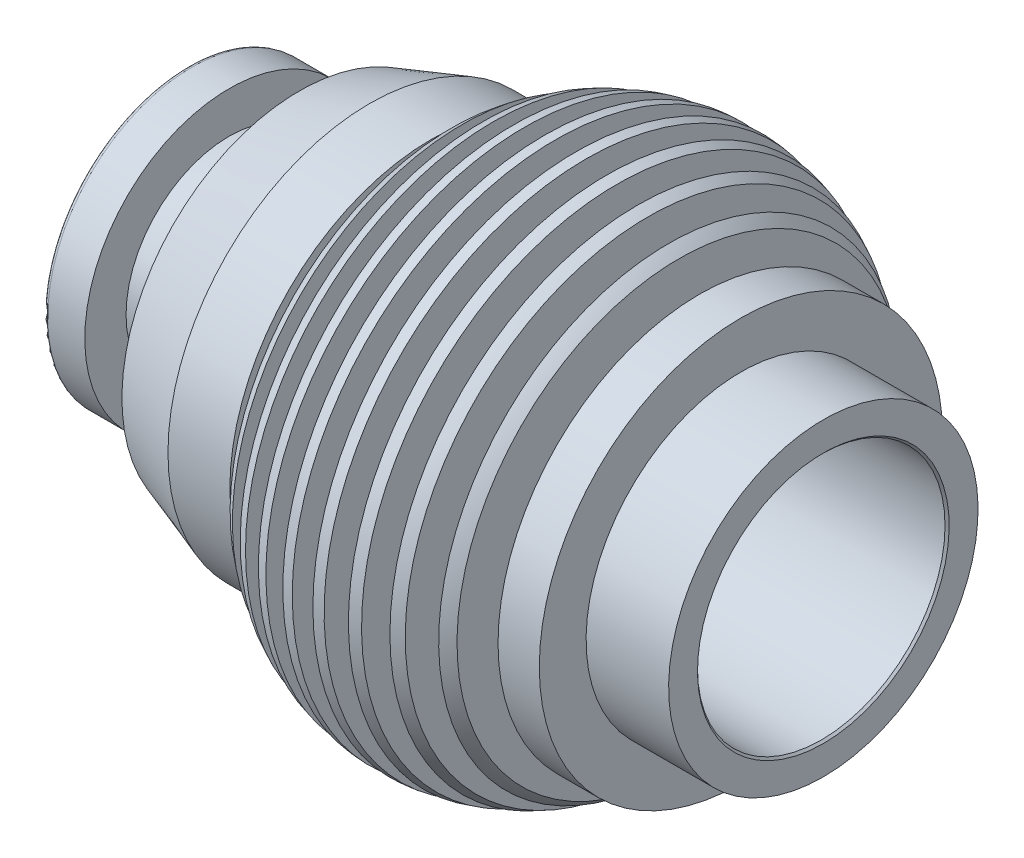
from build123d import *

# Parameters (mm, degrees)
SKETCH4_R          = 7.5
CUT_EXTRUDE1_DEPTH = 179.440382209
CIRPATTERN1_COUNT  = 9
CHAMFER1_SIZE      = 0.5
FILLET2_R          = 1


with BuildPart() as part:
    # Sketch1 → Revolve1 (revolve)
    with BuildSketch(Plane.XY):
        with BuildLine():
            Line((0, 35), (0, 15))
            Line((0, 15), (54, 15))
            Line((54, 15), (54, 30))
            Line((54, 30), (154, 30))
            Line((154, 30), (154, 37.5))
            Line((154, 37.5), (134, 37.5))
            Line((134, 37.5), (134.019334361, 48.86))
            Line((134.019334361, 48.86), (124.019334361, 48.86))
            Line((124.019334361, 48.86), (124.019334361, 40))
            Line((124.019334361, 40), (119.019334361, 40))
            Line((119.019334361, 40), (119.019334361, 53.806804209))
            ThreePointArc((119.019334361, 53.806804209), (117.787313388, 54.801644975), (116.519334361, 55.750229717))
            Line((116.519334361, 55.750229717), (116.519334361, 40))
            Line((116.519334361, 40), (111.519334361, 40))
            Line((111.519334361, 40), (111.519334361, 58.850307256))
            ThreePointArc((111.519334361, 58.850307256), (110.279240504, 59.480194874), (109.019334361, 60.069455171))
            Line((109.019334361, 60.069455171), (109.019334361, 40))
            Line((109.019334361, 40), (104.019334361, 40))
            Line((104.019334361, 40), (104.019334361, 61.94463843))
            ThreePointArc((104.019334361, 61.94463843), (102.774492344, 62.304270611), (101.519334361, 62.626055303))
            Line((101.519334361, 62.626055303), (101.519334361, 40))
            Line((101.519334361, 40), (96.519334361, 40))
            Line((96.519334361, 40), (96.519334361, 63.51762606))
            ThreePointArc((96.519334361, 63.51762606), (95.27094714, 63.645948403), (94.019334361, 63.737614791))
            Line((94.019334361, 63.737614791), (94.019334361, 40))
            Line((94.019334361, 40), (89.019334361, 40))
            Line((89.019334361, 40), (89.019334361, 63.737626161))
            ThreePointArc((89.019334361, 63.737626161), (87.767721666, 63.64596551), (86.519334361, 63.517648918))
            Line((86.519334361, 63.517648918), (86.519334361, 40))
            Line((86.519334361, 40), (81.519334361, 40))
            Line((81.519334361, 40), (81.519334361, 62.626101999))
            ThreePointArc((81.519334361, 62.626101999), (80.26417648, 62.304323607), (79.019334361, 61.944697773))
            Line((79.019334361, 61.944697773), (79.019334361, 40))
            Line((79.019334361, 40), (74.019334361, 40))
            Line((74.019334361, 40), (74.019334361, 60.069542238))
            ThreePointArc((74.019334361, 60.069542238), (72.75942837, 59.480289713), (71.519334361, 58.850409967))
            Line((71.519334361, 58.850409967), (71.519334361, 40))
            Line((71.519334361, 40), (66.519334361, 40))
            Line((66.519334361, 40), (66.519334361, 55.750369564))
            ThreePointArc((66.519334361, 55.750369564), (65.251355628, 54.801796268), (64.019334361, 53.806967156))
            Line((64.019334361, 53.806967156), (64.019334361, 40))
            Line((64.019334361, 40), (59.019334361, 40))
            Line((59.019334361, 40), (59.019334361, 48.86022678))
            Line((59.019334361, 48.86022678), (44.019334361, 48.86022678))
            Line((44.019334361, 48.86022678), (27, 43))
            Line((27, 43), (27, 35))
            ThreePointArc((27, 35), (24.071067812, 27.928932188), (17, 25))
            Line((17, 25), (10, 25))
            Line((10, 25), (10, 35))
            Line((10, 35), (0, 35))
        make_face()
    revolve(axis=Axis((-113.765130781, 0, 0), (1, 0, 0)))

    # Sketch4 → Cut-Extrude1 (cut, through all)
    with BuildSketch(Plane(origin=(0, 0, 0), x_dir=(1, 0, 0), z_dir=(0, 1, 0))):
        with Locations((91.519334361, 0)):
            Circle(SKETCH4_R)
    extrude(amount=-CUT_EXTRUDE1_DEPTH, mode=Mode.SUBTRACT)

    # Sketch11 → Ø5.0 mm Dowel Holes3 (revolve, cut)
    with BuildSketch(Plane(origin=(27, 39, 0), x_dir=(0, 0, 1), z_dir=(0, 1, 0))):
        Polygon((0, 0), (0, 21.502151548), (2.5, 20), (2.5, 0.209774908), (2.75, 0), align=None)
    f_5_0_mm_dowel_holes3 = revolve(axis=Axis((20.65, 39, 0), (1, 0, 0)), mode=Mode.SUBTRACT)

    # CirPattern1: Ø5.0 mm Dowel Holes3 ×9 about axis
    cirpattern1_axis = Axis((54, 0, 0), (-1, 0, 0))
    for i in range(1, CIRPATTERN1_COUNT):
        add(f_5_0_mm_dowel_holes3.rotate(cirpattern1_axis, i * 360 / CIRPATTERN1_COUNT), mode=Mode.SUBTRACT)

    # Chamfer1
    chamfer1_edges = [part.edges().sort_by_distance(p)[0] for p in [
        (0, -15, 0),
        (154, -30, 0),
    ]]
    chamfer(chamfer1_edges, length=CHAMFER1_SIZE)

    # Fillet2
    fillet2_edges = [part.edges().sort_by_distance(p)[0] for p in [
        (0, -35, 0),
        (0, -15.5, 0),
    ]]
    fillet(fillet2_edges, radius=FILLET2_R)


solid = part.part
